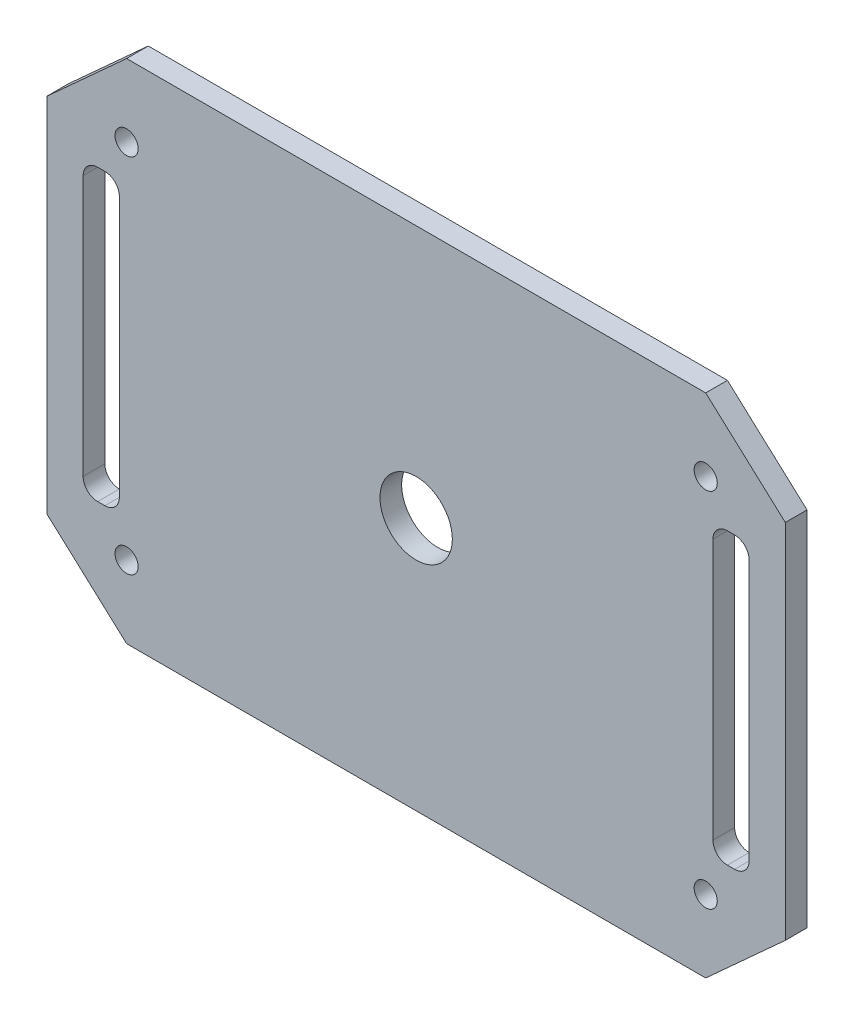
from build123d import *

# Parameters (mm, degrees)
SKETCH1_R           = 1.6
SKETCH1_R_2         = 5
BOSS_EXTRUDE1_DEPTH = 3


with BuildPart() as part:
    # Sketch1 → Boss-Extrude1 (new body)
    with BuildSketch(Plane.XY):
        Polygon((-10.853989547, -33.844947192), (0.146010453, -23.844947192), (80.146010453, -23.844947192), (91.146010453, -33.844947192), (91.146010453, -83.844947192), (80.146010453, -93.844947192), (0.146010453, -93.844947192), (-10.853989547, -83.844947192), align=None)
        with Locations((0.146010453, -33.844947192)):
            Circle(SKETCH1_R, mode=Mode.SUBTRACT)
        with Locations((80.146010453, -33.844947192)):
            Circle(SKETCH1_R, mode=Mode.SUBTRACT)
        with Locations((80.146010453, -83.844947192)):
            Circle(SKETCH1_R, mode=Mode.SUBTRACT)
        with Locations((0.146010453, -83.844947192)):
            Circle(SKETCH1_R, mode=Mode.SUBTRACT)
        with Locations((40.146010453, -58.844947192)):
            Circle(SKETCH1_R_2, mode=Mode.SUBTRACT)
        with BuildLine():
            Line((-3.853989547, -38.844947192), (-2.853989547, -38.844947192))
            ThreePointArc((-2.853989547, -38.844947192), (-1.439775984, -39.430733629), (-0.853989547, -40.844947192))
            Line((-0.853989547, -40.844947192), (-0.853989547, -76.844947192))
            ThreePointArc((-0.853989547, -76.844947192), (-1.439775984, -78.259160754), (-2.853989547, -78.844947192))
            Line((-2.853989547, -78.844947192), (-3.853989547, -78.844947192))
            ThreePointArc((-3.853989547, -78.844947192), (-5.268203109, -78.259160754), (-5.853989547, -76.844947192))
            Line((-5.853989547, -76.844947192), (-5.853989547, -40.844947192))
            ThreePointArc((-5.853989547, -40.844947192), (-5.268203109, -39.430733629), (-3.853989547, -38.844947192))
        make_face(mode=Mode.SUBTRACT)
        with BuildLine():
            Line((84.146010453, -38.844947192), (83.146010453, -38.844947192))
            ThreePointArc((83.146010453, -38.844947192), (81.731796891, -39.430733629), (81.146010453, -40.844947192))
            Line((81.146010453, -40.844947192), (81.146010453, -76.844947192))
            ThreePointArc((81.146010453, -76.844947192), (81.731796891, -78.259160754), (83.146010453, -78.844947192))
            Line((83.146010453, -78.844947192), (84.146010453, -78.844947192))
            ThreePointArc((84.146010453, -78.844947192), (85.560224016, -78.259160754), (86.146010453, -76.844947192))
            Line((86.146010453, -76.844947192), (86.146010453, -40.844947192))
            ThreePointArc((86.146010453, -40.844947192), (85.560224016, -39.430733629), (84.146010453, -38.844947192))
        make_face(mode=Mode.SUBTRACT)
    extrude(amount=BOSS_EXTRUDE1_DEPTH)


solid = part.part
